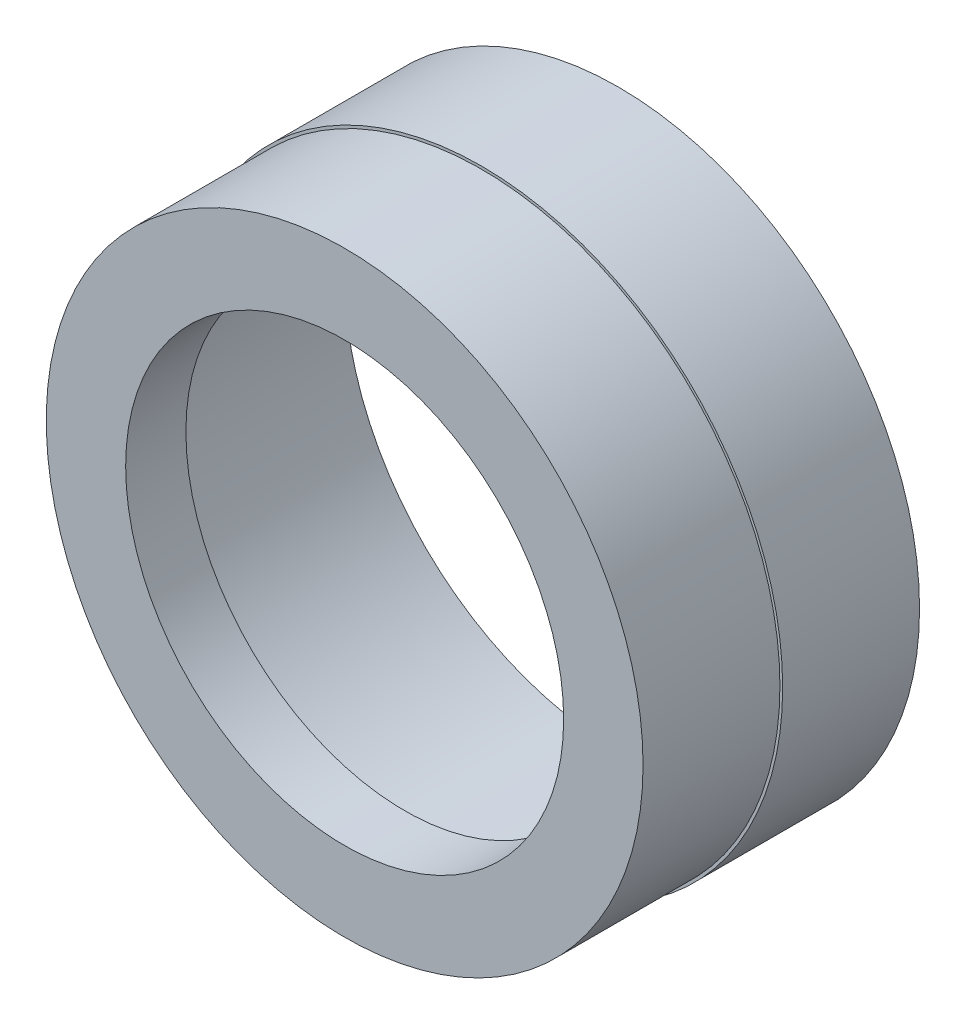
from build123d import *

# Parameters (mm, degrees)
SKETCH1_R           = 5.5
BOSS_EXTRUDE1_DEPTH = 5
SKETCH2_R           = 5
CUT_EXTRUDE1_DEPTH  = 3.9
CUT_EXTRUDE2_REACH  = 11.247
SKETCH3_R           = 4
SKETCH4_OUTSIDE_W   = 16.268
SKETCH4_OUTSIDE_H   = 16.268
SKETCH4_OUTSIDE_R   = 5.45
CUT_EXTRUDE3_DEPTH  = 2.5


with BuildPart() as part:
    # Sketch1 → Boss-Extrude1 (new body)
    with BuildSketch(Plane.XY):
        Circle(SKETCH1_R)
    extrude(amount=-BOSS_EXTRUDE1_DEPTH)

    # Sketch2 → Cut-Extrude1 (cut)
    with BuildSketch(Plane(origin=(0, 0, -5), x_dir=(-1, 0, 0), z_dir=(0, 0, -1))):
        Circle(SKETCH2_R)
    extrude(amount=-CUT_EXTRUDE1_DEPTH, mode=Mode.SUBTRACT)

    # Sketch3 → Cut-Extrude2 (cut, up to next)
    with BuildSketch(Plane.XY, mode=Mode.PRIVATE) as cut_extrude2_sk1:
        Circle(SKETCH3_R)
    cut_extrude2_tool1 = extrude(cut_extrude2_sk1.sketch, amount=-CUT_EXTRUDE2_REACH, mode=Mode.PRIVATE) & part.part
    add(cut_extrude2_tool1.solids().sort_by_distance((0, 0, 0))[0], mode=Mode.SUBTRACT)

    # Sketch4 outside → Cut-Extrude3 (cut)
    with BuildSketch(Plane.XY):
        Rectangle(SKETCH4_OUTSIDE_W, SKETCH4_OUTSIDE_H)
        Circle(SKETCH4_OUTSIDE_R, mode=Mode.SUBTRACT)
    extrude(amount=-CUT_EXTRUDE3_DEPTH, mode=Mode.SUBTRACT)


solid = part.part
